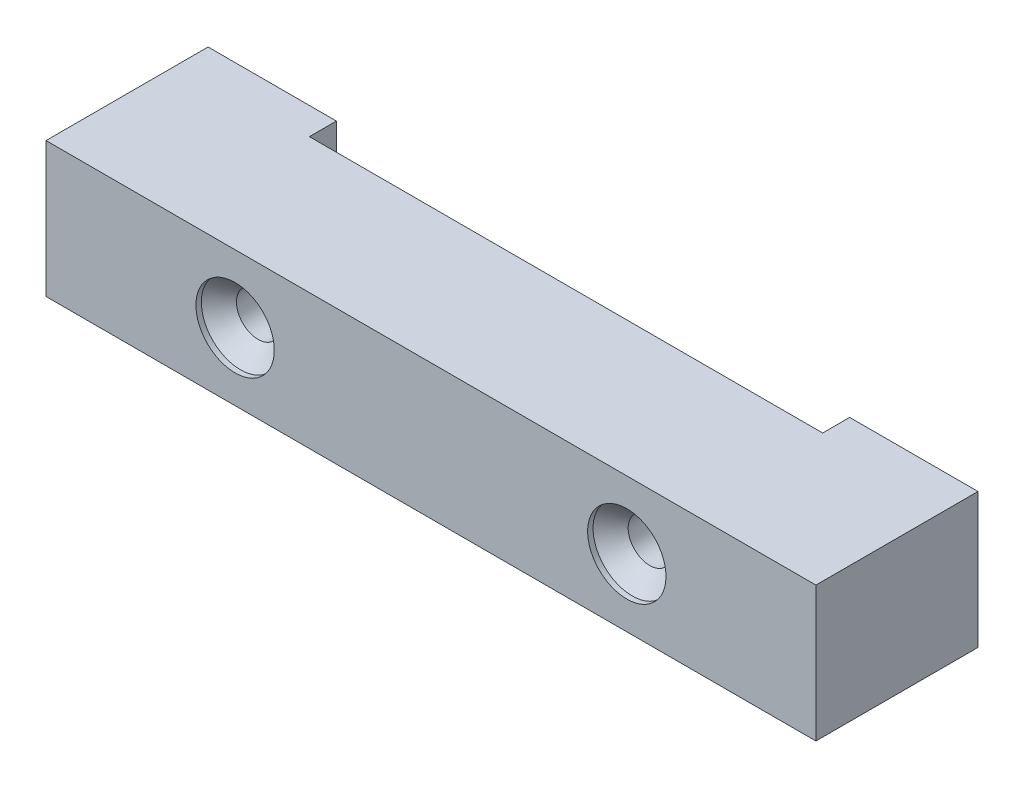
from build123d import *

# Parameters (mm, degrees)
BOSS_EXTRU_1_DEPTH      = 10
ESQUISSE2_R             = 1.55
ENL_V_MAT_EXTRU_1_DEPTH = 7


with BuildPart() as part:
    # Esquisse1 → Boss.-Extru.1 (new body)
    with BuildSketch(Plane(origin=(0, 0, 0), x_dir=(1, 0, 0), z_dir=(0, 1, 0))):
        Polygon((-28.5, -5), (28.5, -5), (28.5, 7), (19, 7), (19, 5), (-19, 5), (-19, 7), (-28.5, 7), align=None)
    extrude(amount=BOSS_EXTRU_1_DEPTH)

    # Esquisse2 → Enlèv. mat.-Extru.1 (cut)
    with BuildSketch(Plane(origin=(0, 0, -7), x_dir=(-1, 0, 0), z_dir=(0, 0, -1))):
        with Locations((-23.5, 5)):
            Circle(ESQUISSE2_R)
    enl_v_mat_extru_1 = extrude(amount=-ENL_V_MAT_EXTRU_1_DEPTH, mode=Mode.SUBTRACT)

    # Esquisse4 → Fraisage pour vis à tête fraisée à 6 pans creux M31 (revolve, cut)
    with BuildSketch(Plane(origin=(14.5, 5, 5), x_dir=(0, -1, 0), z_dir=(1, 0, 0))):
        Polygon((0, 0), (0, 12), (1.6, 12), (1.6, 1.7), (2.9, 0.4), (2.9, 0), align=None)
    fraisage_pour_vis_t_te_frais_e_6_pan = revolve(axis=Axis((14.5, 5, 11.35), (0, 0, -1)), mode=Mode.SUBTRACT)

    # Symétrie1: Enlèv. mat.-Extru.1, Fraisage pour vis à tête fraisée à 6 pans creux M31 across plane
    add(enl_v_mat_extru_1.mirror(Plane(origin=(0, 0, 0), x_dir=(0, 0, 1), z_dir=(1, 0, 0))), mode=Mode.SUBTRACT)
    add(fraisage_pour_vis_t_te_frais_e_6_pan.mirror(Plane(origin=(0, 0, 0), x_dir=(0, 0, 1), z_dir=(1, 0, 0))), mode=Mode.SUBTRACT)


solid = part.part
